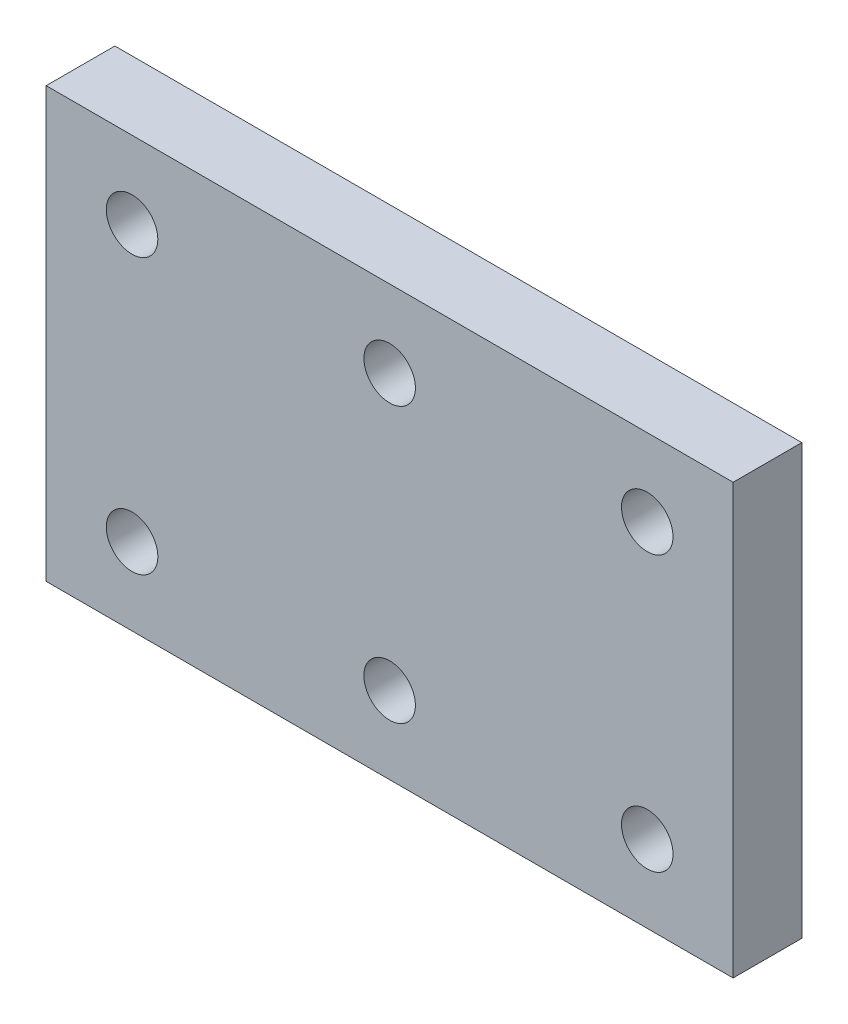
from build123d import *

# Parameters (mm, degrees)
SKETCH_2_W          = 40
SKETCH_2_H          = 25
EXTRUDE_1_DEPTH     = 4
SKETCH_3_R          = 1.5
CUT_EXTRUDE_1_DEPTH = 4


with BuildPart() as part:
    # 草图2 → 凸台-拉伸1 (new body)
    with BuildSketch(Plane.XY):
        Rectangle(SKETCH_2_W, SKETCH_2_H)
    extrude(amount=EXTRUDE_1_DEPTH)

    # 草图3 → 切除-拉伸1 (cut)
    with BuildSketch(Plane.XY.offset(4)):
        with Locations((-15, 8)):
            Circle(SKETCH_3_R)
        with Locations((0, 8)):
            Circle(SKETCH_3_R)
        with Locations(Location((15, 8, 0), (0, 0, 180))):
            Circle(SKETCH_3_R)
        with Locations((15, -8)):
            Circle(SKETCH_3_R)
        with Locations(Location((0, -8, 0), (0, 0, 180))):
            Circle(SKETCH_3_R)
        with Locations(Location((-15, -8, 0), (0, 0, 180))):
            Circle(SKETCH_3_R)
    extrude(amount=-CUT_EXTRUDE_1_DEPTH, mode=Mode.SUBTRACT)


solid = part.part
